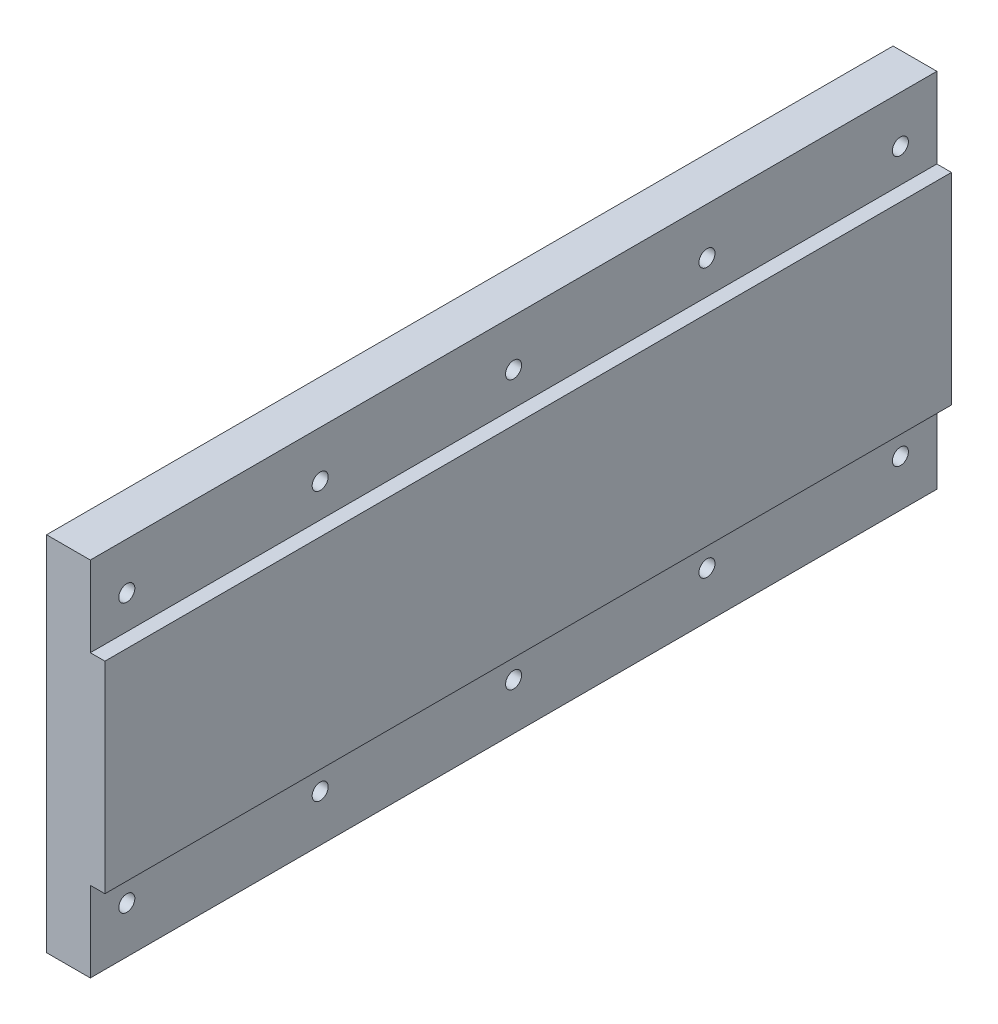
from build123d import *

# Parameters (mm, degrees)
BOSS_EXTRUDE1_DEPTH                                  = 290
CSK_FOR_M10_COUNTERSUNK_FLAT_HEAD_SCREW2_D           = 11
CSK_FOR_M10_COUNTERSUNK_FLAT_HEAD_SCREW2_DEPTH       = 30
CSK_FOR_M10_COUNTERSUNK_FLAT_HEAD_SCREW2_CSINK_D     = 23
CSK_FOR_M10_COUNTERSUNK_FLAT_HEAD_SCREW2_CSINK_ANGLE = 90
CSK_FOR_M10_COUNTERSUNK_FLAT_HEAD_SCREW2_TIP         = 3.304733405


with BuildPart() as part:
    # Sketch1 → Boss-Extrude1 (new, symmetric)
    with BuildSketch(Plane.XY):
        Polygon((-30, 159.287393315), (-30, -88.712606685), (0, -88.712606685), (0, -33.712606685), (10, -33.712606685), (10, 104.287393315), (0, 104.287393315), (0, 159.287393315), align=None)
    extrude(amount=BOSS_EXTRUDE1_DEPTH, both=True)

    # CSK for M10 Countersunk Flat Head Screw2
    with Locations(Plane.ZY.offset(30)):
        with Locations((-265, 127.287393315), (-132.5, 127.287393315), (0, 127.287393315), (132.5, 127.287393315), (265, 127.287393315), (265, -56.712606685), (132.5, -56.712606685), (0, -56.712606685), (-132.5, -56.712606685), (-265, -56.712606685)):
            CounterSinkHole(CSK_FOR_M10_COUNTERSUNK_FLAT_HEAD_SCREW2_D / 2, CSK_FOR_M10_COUNTERSUNK_FLAT_HEAD_SCREW2_CSINK_D / 2, depth=CSK_FOR_M10_COUNTERSUNK_FLAT_HEAD_SCREW2_DEPTH, counter_sink_angle=CSK_FOR_M10_COUNTERSUNK_FLAT_HEAD_SCREW2_CSINK_ANGLE)
            with Locations((0, 0, -(CSK_FOR_M10_COUNTERSUNK_FLAT_HEAD_SCREW2_DEPTH + CSK_FOR_M10_COUNTERSUNK_FLAT_HEAD_SCREW2_TIP / 2))):  # 118° drill point
                Cone(0, CSK_FOR_M10_COUNTERSUNK_FLAT_HEAD_SCREW2_D / 2, CSK_FOR_M10_COUNTERSUNK_FLAT_HEAD_SCREW2_TIP, mode=Mode.SUBTRACT)


solid = part.part
